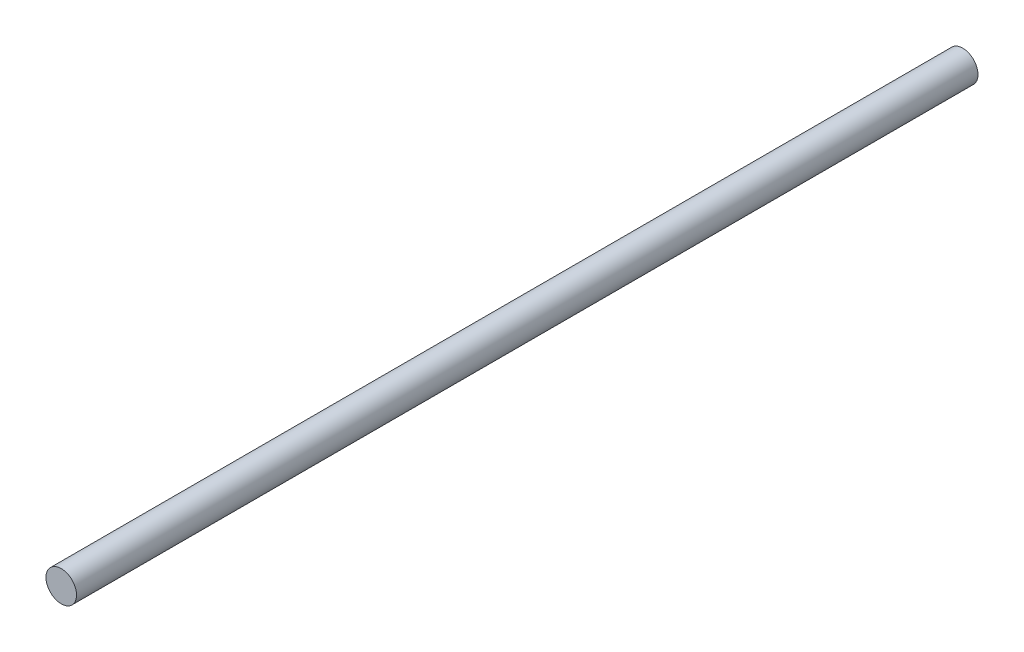
from build123d import *

# Parameters (mm, degrees)
CROQUIS1_R              = 6
SALIENTE_EXTRUIR1_DEPTH = 354


with BuildPart() as part:
    # Croquis1 → Saliente-Extruir1 (new body)
    with BuildSketch(Plane.XY):
        Circle(CROQUIS1_R)
    extrude(amount=SALIENTE_EXTRUIR1_DEPTH)


solid = part.part
